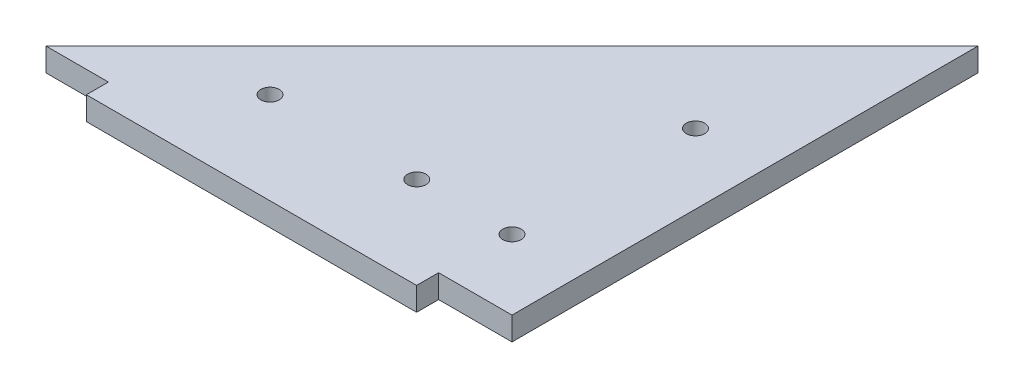
from build123d import *

# Parameters (mm, degrees)
SKETCH1_R           = 2.5
BOSS_EXTRUDE1_DEPTH = 6.35


with BuildPart() as part:
    # Sketch1 → Boss-Extrude1 (new body)
    with BuildSketch(Plane(origin=(0, 0, 0), x_dir=(1, 0, 0), z_dir=(0, 1, 0))):
        Polygon((17, -6), (107, -6), (107, 0), (127, 0), (127, 127), (0, 0), (17, 0), align=None)
        with Locations(Location((42, 19.05, 0), (0, 0, 270))):
            Circle(SKETCH1_R, mode=Mode.SUBTRACT)
        with Locations(Location((82, 19.05, 0), (0, 0, 270))):
            Circle(SKETCH1_R, mode=Mode.SUBTRACT)
        with Locations(Location((107.95, 19.05, 0), (0, 0, 270))):
            Circle(SKETCH1_R, mode=Mode.SUBTRACT)
        with Locations(Location((107.95, 69.05, 0), (0, 0, 270))):
            Circle(SKETCH1_R, mode=Mode.SUBTRACT)
    extrude(amount=BOSS_EXTRUDE1_DEPTH)


solid = part.part
